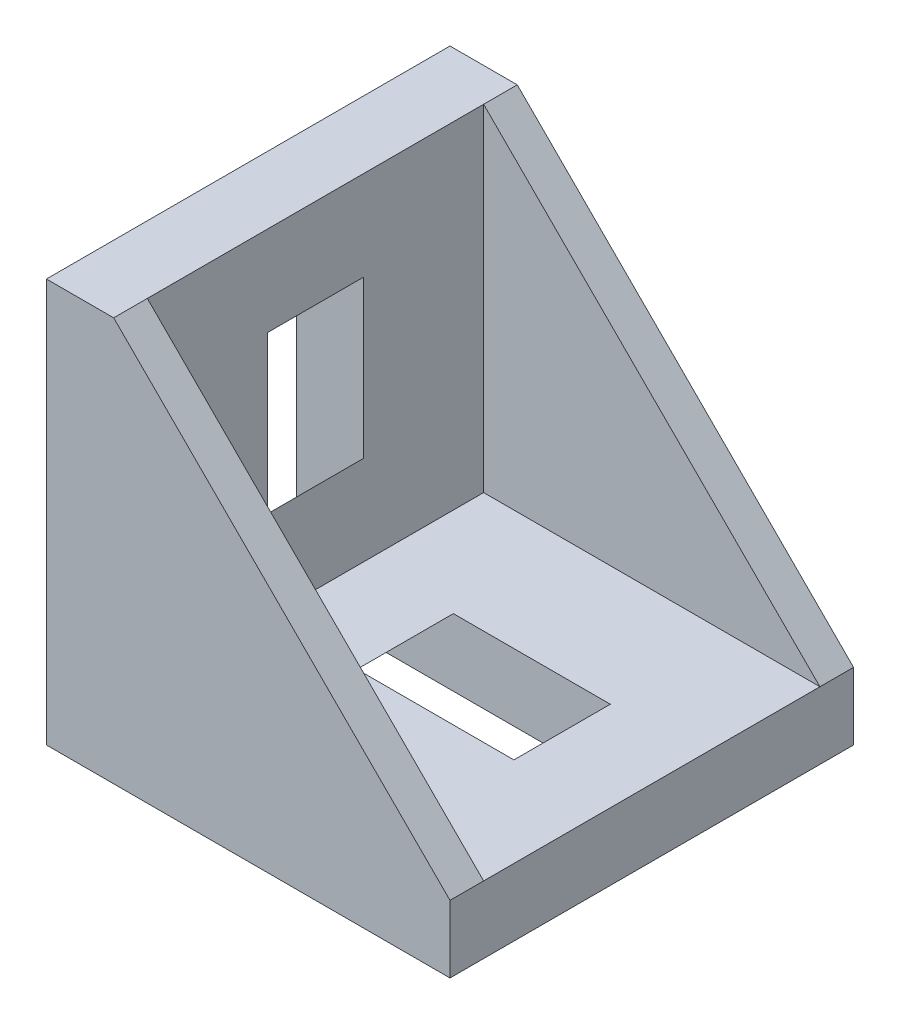
from build123d import *

# Parameters (mm, degrees)
BOSS_EXTRUDE1_DEPTH = 9
CUT_EXTRUDE1_DEPTH  = 7.5
CUT_EXTRUDE2_DEPTH  = 2.15


with BuildPart() as part:
    # Sketch1 → Boss-Extrude1 (new, symmetric)
    with BuildSketch(Plane.XY):
        Polygon((0, 0), (0, 18), (3, 18), (18, 3), (18, 0), align=None)
    extrude(amount=BOSS_EXTRUDE1_DEPTH, both=True)

    # Sketch2 → Cut-Extrude1 (cut, symmetric)
    with BuildSketch(Plane.XY):
        Polygon((3, 18), (3, 3), (18, 3), align=None)
    extrude(amount=CUT_EXTRUDE1_DEPTH, both=True, mode=Mode.SUBTRACT)

    # Sketch3 → Cut-Extrude2 (cut, symmetric)
    with BuildSketch(Plane.XY):
        Polygon((0, 14), (3, 14), (3, 7), (0, 4), align=None)
        Polygon((7, 3), (14, 3), (14, 0), (4, 0), align=None)
    extrude(amount=CUT_EXTRUDE2_DEPTH, both=True, mode=Mode.SUBTRACT)


solid = part.part
